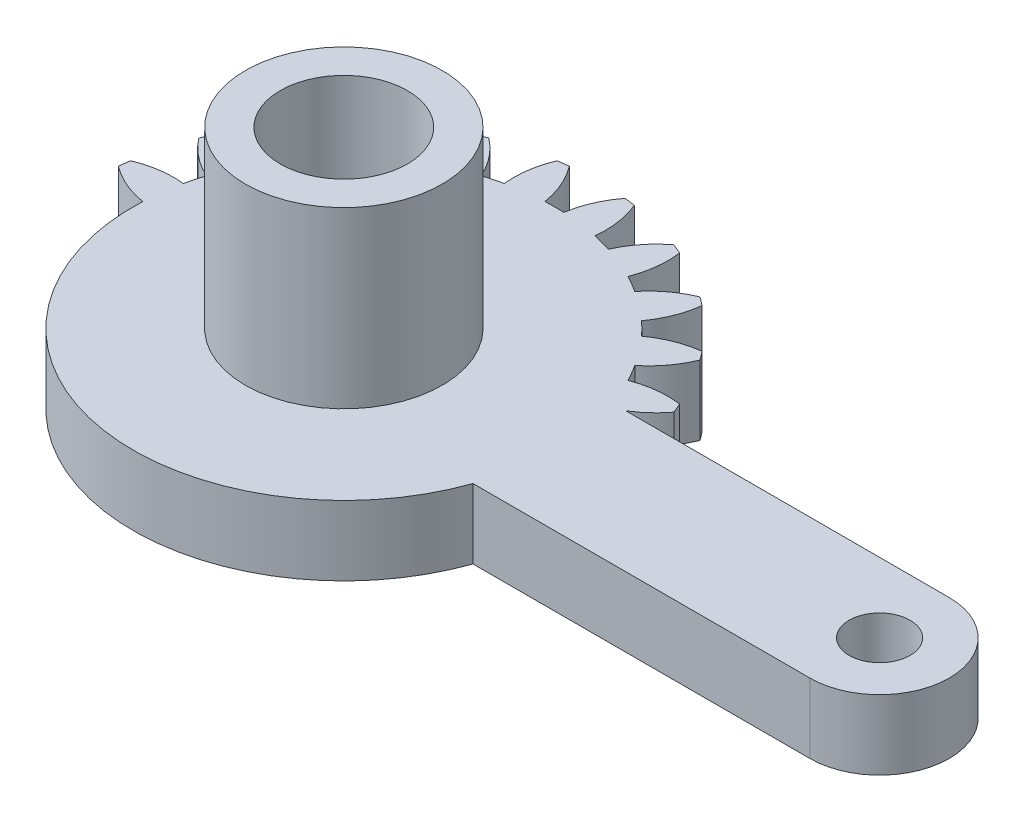
from build123d import *

# Parameters (mm, degrees)
SKETCH1_R           = 1.75
BOSS_EXTRUDE1_DEPTH = 4
SKETCH_1_R          = 3.65
CUT_EXTRUDE_1_DEPTH = 29.890195164
SKETCH_2_R          = 5.65
SKETCH_2_R_2        = 3.65
EXTRUDE_1_DEPTH     = 10


with BuildPart() as part:
    # Sketch1 → Boss-Extrude1 (new body)
    with BuildSketch(Plane(origin=(0, 4, 0), x_dir=(1, 0, 0), z_dir=(0, 1, 0))):
        with BuildLine():
            Line((1.305695063, -4), (20.643657446, -4))
            ThreePointArc((20.643657446, -4), (24.643657446, 0), (20.643657446, 4))
            Line((20.643657446, 4), (2.081641936, 4))
            ThreePointArc((2.081641936, 4), (2.861028333, 4.588201733), (3.521749436, 5.30713988))
            ThreePointArc((3.521749436, 5.30713988), (3.405395609, 5.596745198), (3.282888305, 5.883801663))
            ThreePointArc((3.282888305, 5.883801663), (1.93527598, 5.894040025), (0.627094961, 5.57027124))
            ThreePointArc((0.627094961, 5.57027124), (0.366286148, 6.046375), (0.084372603, 6.510293938))
            ThreePointArc((0.084372603, 6.510293938), (1.018855105, 7.48132754), (1.683794586, 8.65351323))
            ThreePointArc((1.683794586, 8.65351323), (1.496450048, 8.903135899), (1.303821399, 9.148703928))
            ThreePointArc((1.303821399, 9.148703928), (-0.000522033, 8.809805691), (-1.180330337, 8.158486898))
            ThreePointArc((-1.180330337, 8.158486898), (-1.555477026, 8.550865528), (-1.947855656, 8.926012217))
            ThreePointArc((-1.947855656, 8.926012217), (-1.296536862, 10.105820521), (-0.957638625, 11.410163953))
            ThreePointArc((-0.957638625, 11.410163953), (-1.203206655, 11.602792602), (-1.452829324, 11.79013714))
            ThreePointArc((-1.452829324, 11.79013714), (-2.625015014, 11.125197659), (-3.596048616, 10.190715157))
            ThreePointArc((-3.596048616, 10.190715157), (-4.059967554, 10.472628702), (-4.536071314, 10.733437515))
            ThreePointArc((-4.536071314, 10.733437515), (-4.212302529, 12.041618533), (-4.222540891, 13.389230859))
            ThreePointArc((-4.222540891, 13.389230859), (-4.509597355, 13.511738163), (-4.799202674, 13.62809199))
            ThreePointArc((-4.799202674, 13.62809199), (-5.759348103, 12.682425791), (-6.455432668, 11.528463019))
            ThreePointArc((-6.455432668, 11.528463019), (-6.976508546, 11.680699536), (-7.503891752, 11.809396783))
            ThreePointArc((-7.503891752, 11.809396783), (-7.529737283, 13.156800143), (-7.888414517, 14.455843809))
            ThreePointArc((-7.888414517, 14.455843809), (-8.197396993, 14.499881098), (-8.507248835, 14.537314892))
            ThreePointArc((-8.507248835, 14.537314892), (-9.18992168, 13.375367565), (-9.563620196, 12.080565177))
            ThreePointArc((-9.563620196, 12.080565177), (-10.106342554, 12.09275), (-10.649064912, 12.080565177))
            ThreePointArc((-10.649064912, 12.080565177), (-11.022763428, 13.375367565), (-11.705436272, 14.537314892))
            ThreePointArc((-11.705436272, 14.537314892), (-12.015288115, 14.499881098), (-12.324270591, 14.455843809))
            ThreePointArc((-12.324270591, 14.455843809), (-12.682947825, 13.156800143), (-12.708793355, 11.809396783))
            ThreePointArc((-12.708793355, 11.809396783), (-13.236176561, 11.680699536), (-13.757252439, 11.528463019))
            ThreePointArc((-13.757252439, 11.528463019), (-14.453337005, 12.682425791), (-15.413482434, 13.62809199))
            ThreePointArc((-15.413482434, 13.62809199), (-15.703087752, 13.511738163), (-15.990144217, 13.389230859))
            ThreePointArc((-15.990144217, 13.389230859), (-16.000382579, 12.041618533), (-15.676613793, 10.733437515))
            ThreePointArc((-15.676613793, 10.733437515), (-16.152717554, 10.472628702), (-16.616636492, 10.190715157))
            ThreePointArc((-16.616636492, 10.190715157), (-17.587670094, 11.125197659), (-18.759855783, 11.79013714))
            ThreePointArc((-18.759855783, 11.79013714), (-19.009478453, 11.602792602), (-19.255046482, 11.410163953))
            ThreePointArc((-19.255046482, 11.410163953), (-18.916148245, 10.105820521), (-18.264829452, 8.926012217))
            ThreePointArc((-18.264829452, 8.926012217), (-18.657208082, 8.550865528), (-19.032354771, 8.158486898))
            ThreePointArc((-19.032354771, 8.158486898), (-20.212163074, 8.809805691), (-21.516506507, 9.148703928))
            ThreePointArc((-21.516506507, 9.148703928), (-21.709135156, 8.903135899), (-21.896479694, 8.65351323))
            ThreePointArc((-21.896479694, 8.65351323), (-21.231540213, 7.48132754), (-20.297057711, 6.510293938))
            ThreePointArc((-20.297057711, 6.510293938), (-20.578971255, 6.046375), (-20.839780068, 5.57027124))
            ThreePointArc((-20.839780068, 5.57027124), (-22.147961087, 5.894040025), (-23.495573413, 5.883801663))
            ThreePointArc((-23.495573413, 5.883801663), (-23.618080717, 5.596745198), (-23.734434544, 5.30713988))
            ThreePointArc((-23.734434544, 5.30713988), (-22.788768345, 4.346994451), (-21.634805572, 3.650909885))
            ThreePointArc((-21.634805572, 3.650909885), (-21.78704209, 3.129834008), (-21.915739337, 2.602450802))
            ThreePointArc((-21.915739337, 2.602450802), (-23.263142697, 2.576605271), (-24.562186363, 2.217928037))
            ThreePointArc((-24.562186363, 2.217928037), (-24.606223651, 1.908945561), (-24.643657446, 1.599093719))
            ThreePointArc((-24.643657446, 1.599093719), (-23.481710119, 0.916420874), (-22.186907731, 0.542722358))
            ThreePointArc((-22.186907731, 0.542722358), (-12.402167869, -11.872817218), (1.305695063, -4))
        make_face()
        with Locations(Location((20.643657446, 0, 0), (0, 0, 90))):
            Circle(SKETCH1_R, mode=Mode.SUBTRACT)
    extrude(amount=-BOSS_EXTRUDE1_DEPTH)

    # 草图1 → 切除-拉伸1 (cut, through all)
    with BuildSketch(Plane.XZ):
        with Locations(Location((-10.106342554, 0, 0), (0, 0, 270))):
            Circle(SKETCH_1_R)
    extrude(amount=-CUT_EXTRUDE_1_DEPTH, mode=Mode.SUBTRACT)

    # 草图2 → 凸台-拉伸1 (add)
    with BuildSketch(Plane(origin=(0, 4, 0), x_dir=(1, 0, 0), z_dir=(0, 1, 0))):
        with Locations(Location((-10.106342554, 0, 0), (0, 0, 270))):
            Circle(SKETCH_2_R)
        with Locations(Location((-10.106342554, 0, 0), (0, 0, 90))):
            Circle(SKETCH_2_R_2, mode=Mode.SUBTRACT)
    extrude(amount=EXTRUDE_1_DEPTH)


solid = part.part
